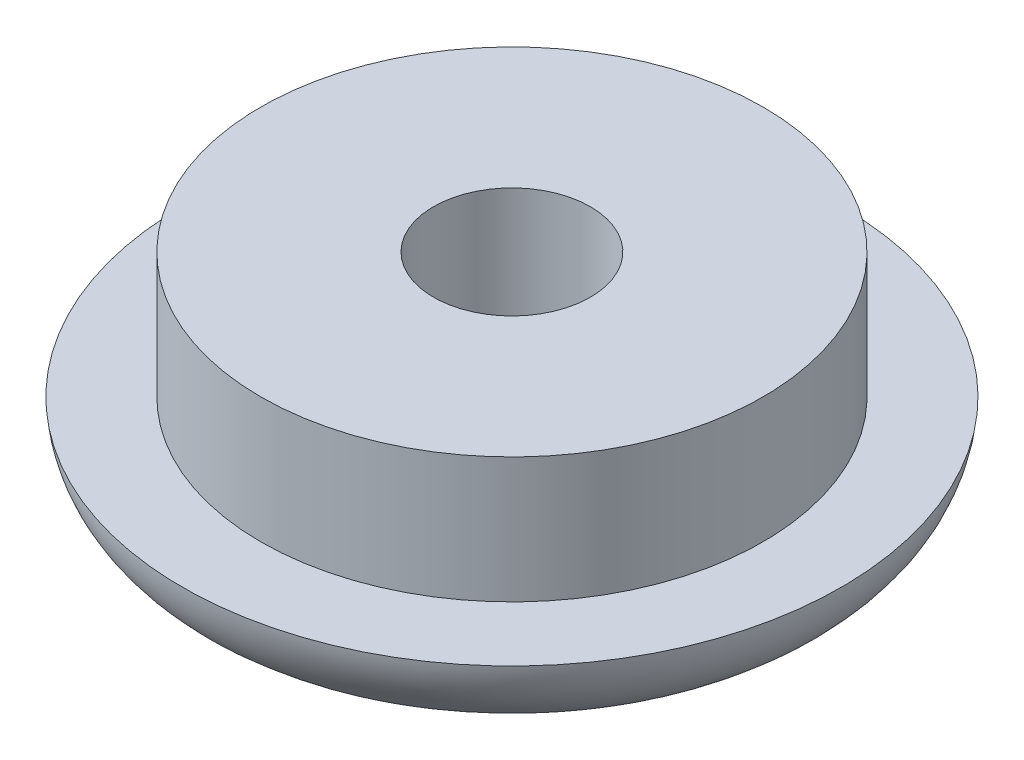
from build123d import *

# Parameters (mm, degrees)
M3X0_5_TAPPED_HOLE1_D     = 2.5
M3X0_5_TAPPED_HOLE1_DEPTH = 4.5
M3X0_5_TAPPED_HOLE1_TIP   = 0.751075774


with BuildPart() as part:
    # Sketch1 → Revolve1 (revolve)
    with BuildSketch(Plane.XY, mode=Mode.PRIVATE) as revolve1_sk:
        with BuildLine():
            Line((-2.5, 0), (-15, 0))
            ThreePointArc((-15, 0), (-19.069705149, 1.583048928), (-21, 5.5))
            Line((-21, 5.5), (-16, 5.5))
            Line((-16, 5.5), (-16, 13.5))
            Line((-16, 13.5), (-5, 13.5))
            Line((-5, 13.5), (-5, 5.5))
            Line((-5, 5.5), (-2.5, 3))
            Line((-2.5, 3), (-2.5, 0))
        make_face()
    revolve(revolve1_sk.sketch.rotate(Axis((0, 0, 0), (0, 1, 0)), 270), axis=Axis((0, 0, 0), (0, 1, 0)))

    # M3x0.5 Tapped Hole1
    with Locations(Plane(origin=(0, 0, 0), x_dir=(-1, 0, 0), z_dir=(0, -1, 0))):
        with Locations((12.5, 0), (0, 9.5), (-12.5, 0), (0, -9.5)):
            Hole(M3X0_5_TAPPED_HOLE1_D / 2, depth=M3X0_5_TAPPED_HOLE1_DEPTH)
            with Locations((0, 0, -(M3X0_5_TAPPED_HOLE1_DEPTH + M3X0_5_TAPPED_HOLE1_TIP / 2))):  # 118° drill point
                Cone(0, M3X0_5_TAPPED_HOLE1_D / 2, M3X0_5_TAPPED_HOLE1_TIP, mode=Mode.SUBTRACT)


solid = part.part
